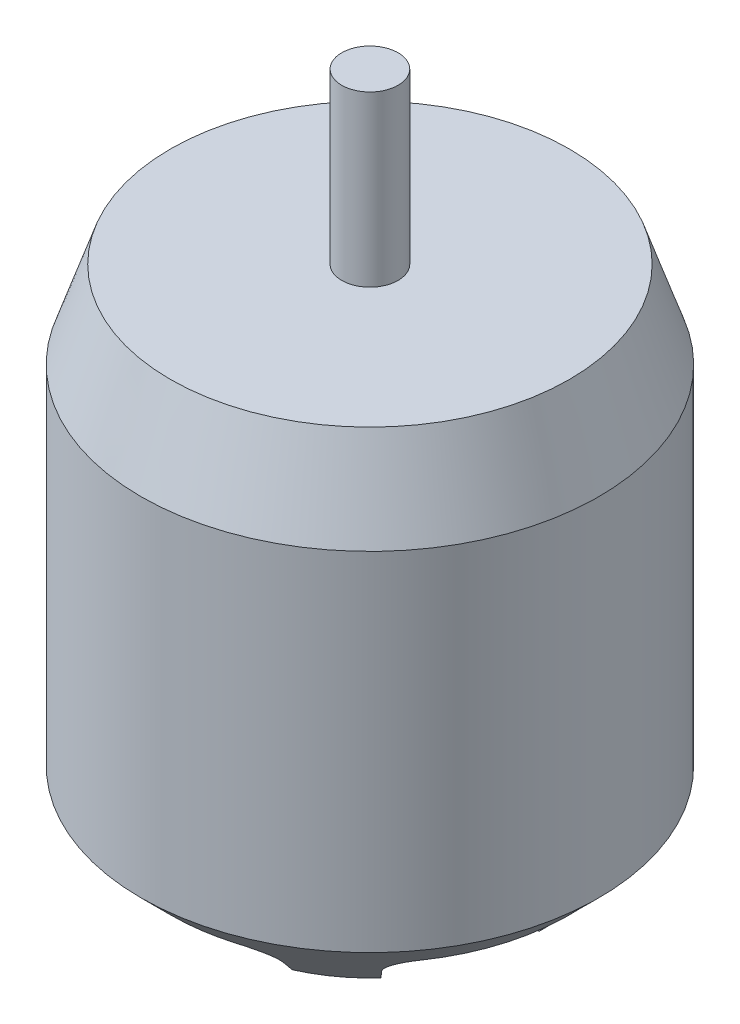
from build123d import *

# Parameters (mm, degrees)
SKETCH1_R           = 24.375
BOSS_EXTRUDE1_DEPTH = 54.25
CHAMFER1_SIZE       = 9.25
CHAMFER1_SIZE2      = 3.125
CHAMFER2_SIZE       = 8
CUT_EXTRUDE1_DEPTH  = 10
SKETCH3_R           = 7
BOSS_EXTRUDE2_DEPTH = 5
SKETCH4_R           = 3
BOSS_EXTRUDE3_DEPTH = 18


with BuildPart() as part:
    # Sketch1 → Boss-Extrude1 (new body)
    with BuildSketch(Plane(origin=(0, 0, 0), x_dir=(1, 0, 0), z_dir=(0, 1, 0))):
        with Locations(Location((0, 0, 0), (0, 0, 270))):
            Circle(SKETCH1_R)
    extrude(amount=BOSS_EXTRUDE1_DEPTH)

    # Chamfer1
    chamfer1_edges = [part.edges().sort_by_distance(p)[0] for p in [
        (0, 54.25, -24.375),
    ]]
    chamfer1_side = [part.faces().sort_by_distance(p)[0] for p in [
        (0, 27.125, -24.375),
    ]]
    chamfer(chamfer1_edges, length=CHAMFER1_SIZE, length2=CHAMFER1_SIZE2, reference=chamfer1_side[0])

    # Chamfer2
    chamfer2_edges = [part.edges().sort_by_distance(p)[0] for p in [
        (0, 0, -24.375),
    ]]
    chamfer(chamfer2_edges, length=CHAMFER2_SIZE)

    # Sketch2 → Cut-Extrude1 (cut)
    with BuildSketch(Plane.XZ):
        with BuildLine():
            Line((-3.752441842, -18.058791036), (-3.127941128, -14.70103845))
            ThreePointArc((-3.127941128, -14.70103845), (-3.399785699, -13.030905705), (-4.673081087, -11.916472345))
            ThreePointArc((-4.673081087, -11.916472345), (-7.523651229, -10.355417528), (-9.889177203, -8.126756686))
            ThreePointArc((-9.889177203, -8.126756686), (-11.342536225, -7.260159658), (-13.014931448, -7.517719508))
            Line((-13.014931448, -7.517719508), (-16.015362591, -9.149257594))
            ThreePointArc((-16.015362591, -9.149257594), (-17.266321132, -10.825132639), (-16.80622135, -12.865172499))
            ThreePointArc((-16.80622135, -12.865172499), (-12.440537552, -17.122930967), (-7.04209813, -19.959223267))
            ThreePointArc((-7.04209813, -19.959223267), (-4.959726276, -19.766397177), (-3.752441842, -18.058791036))
        make_face()
        with BuildLine():
            Line((-18.33449919, -2.011689062), (-14.94810538, -1.568021924))
            ThreePointArc((-14.94810538, -1.568021924), (-13.443719342, -0.793382972), (-12.777300147, 0.761971751))
            ThreePointArc((-12.777300147, 0.761971751), (-12.173523409, 3.955417528), (-10.784928719, 6.893860495))
            ThreePointArc((-10.784928719, 6.893860495), (-10.409858605, 8.543880272), (-11.171611124, 10.054832276))
            Line((-11.171611124, 10.054832276), (-13.650480266, 12.404238871))
            ThreePointArc((-13.650480266, 12.404238871), (-15.630899596, 13.076097273), (-17.428914147, 12.008109392))
            ThreePointArc((-17.428914147, 12.008109392), (-20.129212597, 6.540377643), (-21.158477347, 0.529694131))
            ThreePointArc((-21.158477347, 0.529694131), (-20.331600546, -1.391172651), (-18.33449919, -2.011689062))
        make_face()
        with BuildLine():
            Line((3.752441842, -18.058791036), (3.127941128, -14.70103845))
            ThreePointArc((3.127941128, -14.70103845), (3.399785699, -13.030905705), (4.673081087, -11.916472345))
            ThreePointArc((4.673081087, -11.916472345), (7.523651229, -10.355417528), (9.889177203, -8.126756686))
            ThreePointArc((9.889177203, -8.126756686), (11.342536225, -7.260159658), (13.014931448, -7.517719508))
            Line((13.014931448, -7.517719508), (16.015362591, -9.149257594))
            ThreePointArc((16.015362591, -9.149257594), (17.266321132, -10.825132639), (16.80622135, -12.865172499))
            ThreePointArc((16.80622135, -12.865172499), (12.440537552, -17.122930967), (7.04209813, -19.959223267))
            ThreePointArc((7.04209813, -19.959223267), (4.959726276, -19.766397177), (3.752441842, -18.058791036))
        make_face()
        with BuildLine():
            Line((-7.578901824, 16.815498821), (-6.110496064, 13.731947606))
            ThreePointArc((-6.110496064, 13.731947606), (-4.908889789, 12.540568062), (-3.223724689, 12.387396786))
            ThreePointArc((-3.223724689, 12.387396786), (0, 12.8), (3.223724689, 12.387396786))
            ThreePointArc((3.223724689, 12.387396786), (4.908889789, 12.540568062), (6.110496064, 13.731947606))
            Line((6.110496064, 13.731947606), (7.578901824, 16.815498821))
            ThreePointArc((7.578901824, 16.815498821), (7.605893907, 18.906605194), (6.034560021, 20.286592244))
            ThreePointArc((6.034560021, 20.286592244), (0, 21.16510665), (-6.034560021, 20.286592244))
            ThreePointArc((-6.034560021, 20.286592244), (-7.605893907, 18.906605194), (-7.578901824, 16.815498821))
        make_face()
        with BuildLine():
            Line((13.650480266, 12.404238871), (11.171611124, 10.054832276))
            ThreePointArc((11.171611124, 10.054832276), (10.409858605, 8.543880272), (10.784928719, 6.893860495))
            ThreePointArc((10.784928719, 6.893860495), (12.173523409, 3.955417528), (12.777300147, 0.761971751))
            ThreePointArc((12.777300147, 0.761971751), (13.443719342, -0.793382972), (14.94810538, -1.568021924))
            Line((14.94810538, -1.568021924), (18.33449919, -2.011689062))
            ThreePointArc((18.33449919, -2.011689062), (20.331600546, -1.391172651), (21.158477347, 0.529694131))
            ThreePointArc((21.158477347, 0.529694131), (20.129212597, 6.540377643), (17.428914147, 12.008109392))
            ThreePointArc((17.428914147, 12.008109392), (15.630899596, 13.076097273), (13.650480266, 12.404238871))
        make_face()
    extrude(amount=-CUT_EXTRUDE1_DEPTH, mode=Mode.SUBTRACT)

    # Sketch3 → Boss-Extrude2 (add)
    with BuildSketch(Plane(origin=(0, 0, 0), x_dir=(-1, 0, 0), z_dir=(0, -1, 0))):
        with Locations(Location((0, 0, 0), (0, 0, 270))):
            Circle(SKETCH3_R)
    extrude(amount=BOSS_EXTRUDE2_DEPTH)

    # Sketch4 → Boss-Extrude3 (add)
    with BuildSketch(Plane(origin=(0, 54.25, 0), x_dir=(1, 0, 0), z_dir=(0, 1, 0))):
        with Locations(Location((0, 0, 0), (0, 0, 270))):
            Circle(SKETCH4_R)
    extrude(amount=BOSS_EXTRUDE3_DEPTH)


solid = part.part
